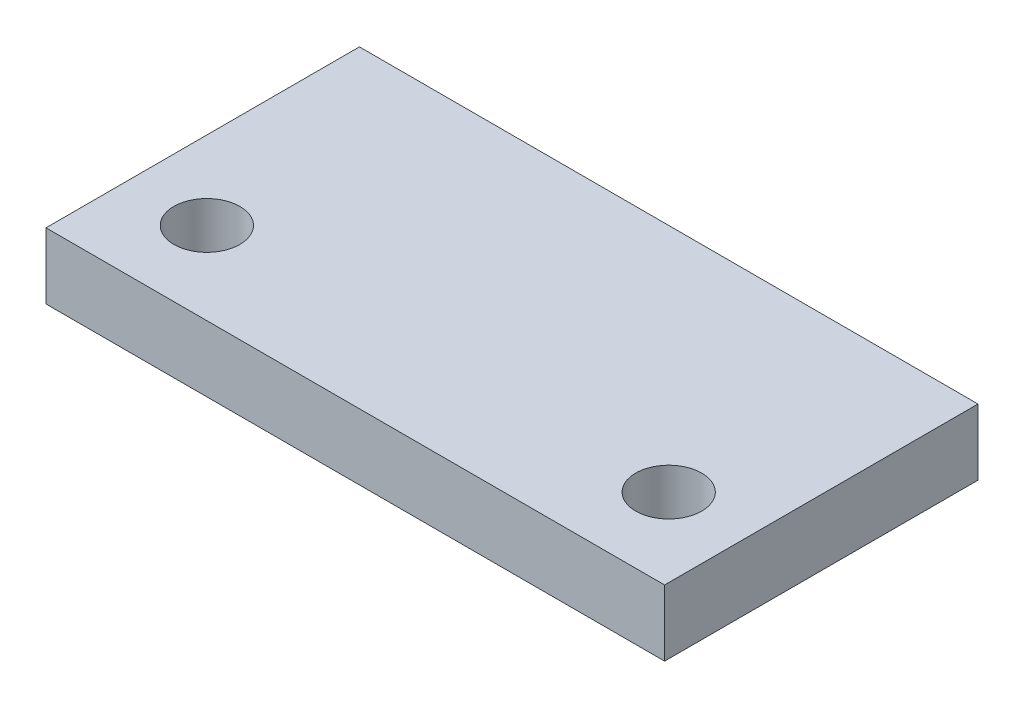
from build123d import *

# Parameters (mm, degrees)
SKETCH1_W               = 75
SKETCH1_H               = 8
BOSS_EXTRUDE1_DEPTH     = 38
CUT_EXTRUDE1_DEPTH      = 54.983793864
CUT_EXTRUDE1_DEPTH_BACK = 54.983793864
SKETCH2_R               = 4


with BuildPart() as part:
    # Sketch1 → Boss-Extrude1 (new body)
    with BuildSketch(Plane.XY):
        with Locations((0, -4)):
            Rectangle(SKETCH1_W, SKETCH1_H)
    extrude(amount=BOSS_EXTRUDE1_DEPTH)

    # Sketch2 → Cut-Extrude1 (cut, two sides: drawn at the far end of the back side and taken through both)
    with BuildSketch(Plane(origin=(0, 0, 0), x_dir=(1, 0, 0), z_dir=(0, 1, 0)).offset(-CUT_EXTRUDE1_DEPTH_BACK)):
        with Locations(Location((-28, -28, 0), (0, 0, 180))):
            Circle(SKETCH2_R)
        with Locations((28, -28)):
            Circle(SKETCH2_R)
    extrude(amount=CUT_EXTRUDE1_DEPTH + CUT_EXTRUDE1_DEPTH_BACK, mode=Mode.SUBTRACT)


solid = part.part
